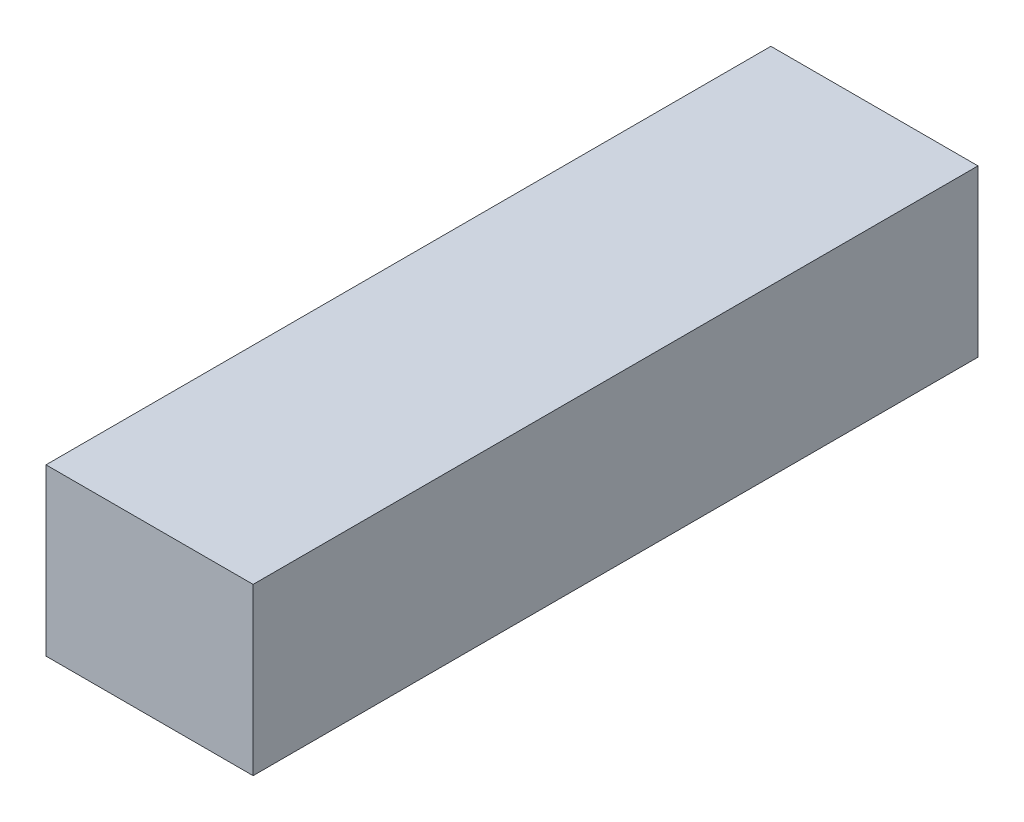
from build123d import *

# Parameters (mm, degrees)
SKETCH1_W           = 25.4
SKETCH1_H           = 88.9
BOSS_EXTRUDE1_DEPTH = 20.32


with BuildPart() as part:
    # Sketch1 → Boss-Extrude1 (new body)
    with BuildSketch(Plane(origin=(0, 0, 0), x_dir=(1, 0, 0), z_dir=(0, 1, 0))):
        Rectangle(SKETCH1_W, SKETCH1_H)
    extrude(amount=BOSS_EXTRUDE1_DEPTH)


solid = part.part
